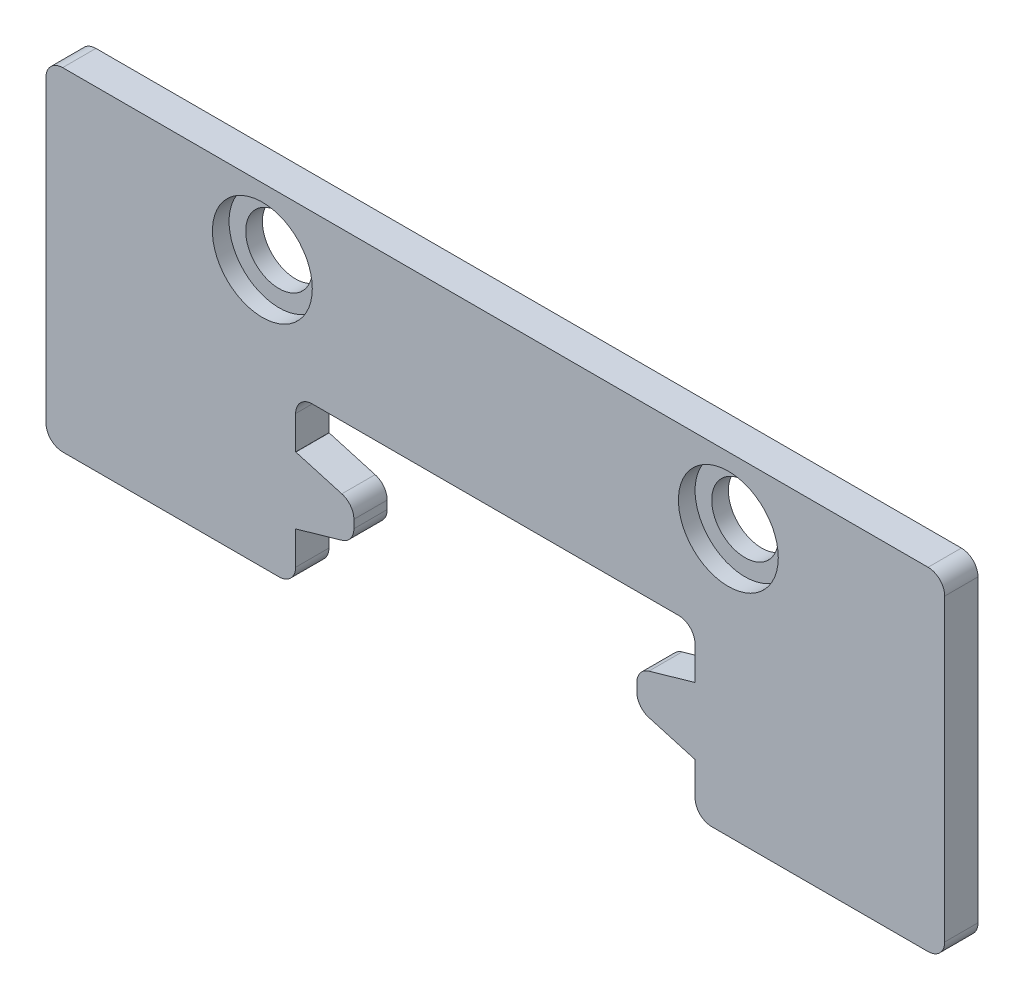
from build123d import *
from OCP.BRepFilletAPI import BRepFilletAPI_MakeChamfer

# Parameters (mm, degrees)
BOSS_EXTRUDE1_DEPTH = 1
CHAMFER1_SIZE       = 0.5
CHAMFER1_SIZE2      = 1.743707222
FILLET1_R           = 0.5
SKETCH2_R           = 1
CUT_EXTRUDE1_DEPTH  = 1
FILLET2_R           = 0.5
SKETCH3_R           = 1.5
CUT_EXTRUDE2_DEPTH  = 0.5


with BuildPart() as part:
    # Sketch1 → Boss-Extrude1 (new body)
    with BuildSketch(Plane.XY):
        Polygon((-6, -1.5), (-6, 0), (6, 0), (6, -1.5), (4.25, -1.5), (4.25, -3.5), (6, -3.5), (6, -5), (13.5, -5), (13.5, 5), (-13.5, 5), (-13.5, -5), (-6, -5), (-6, -3.5), (-4.25, -3.5), (-4.25, -1.5), align=None)
    extrude(amount=BOSS_EXTRUDE1_DEPTH)

    # Chamfer1: one chamfer whose edges measure the first distance from different faces: ONE call of the kernel's chamfer builder (chamfer() names one face for all edges)
    chamfer1_edges_1 = [part.edges().sort_by_distance(p)[0] for p in [
        (4.25, -3.5, 0.5),
        (4.25, -1.5, 0.5),
    ]]
    chamfer1_side_1 = [part.faces().sort_by_distance(p)[0] for p in [
        (4.25, -2.5, 0.5),
    ]]
    chamfer1_edges_2 = [part.edges().sort_by_distance(p)[0] for p in [
        (-4.25, -1.5, 0.5),
        (-4.25, -3.5, 0.5),
    ]]
    chamfer1_side_2 = [part.faces().sort_by_distance(p)[0] for p in [
        (-4.25, -2.5, 0.5),
    ]]
    chamfer1 = BRepFilletAPI_MakeChamfer(part.part.solid().wrapped)
    for e in chamfer1_edges_1:
        chamfer1.Add(CHAMFER1_SIZE, CHAMFER1_SIZE2, e.wrapped, chamfer1_side_1[0].wrapped)  # the first distance lies on this face
    for e in chamfer1_edges_2:
        chamfer1.Add(CHAMFER1_SIZE, CHAMFER1_SIZE2, e.wrapped, chamfer1_side_2[0].wrapped)  # the first distance lies on this face
    add(Compound.cast(chamfer1.Shape()), mode=Mode.REPLACE)

    # Fillet1
    fillet1_edges = [part.edges().sort_by_distance(p)[0] for p in [
        (4.25, -2, 0.5),
        (4.25, -3, 0.5),
        (-4.25, -2, 0.5),
        (-4.25, -3, 0.5),
    ]]
    fillet(fillet1_edges, radius=FILLET1_R)

    # Sketch2 → Cut-Extrude1 (cut)
    with BuildSketch(Plane.XY.offset(1)):
        with Locations((-7, 3)):
            Circle(SKETCH2_R)
        with Locations((7, 3)):
            Circle(SKETCH2_R)
    extrude(amount=-CUT_EXTRUDE1_DEPTH, mode=Mode.SUBTRACT)

    # Fillet2
    fillet2_edges = [part.edges().sort_by_distance(p)[0] for p in [
        (6, -5, 0.5),
        (6, 0, 0.5),
        (-6, 0, 0.5),
        (-6, -5, 0.5),
        (-13.5, -5, 0.5),
        (-13.5, 5, 0.5),
        (13.5, 5, 0.5),
        (13.5, -5, 0.5),
    ]]
    fillet(fillet2_edges, radius=FILLET2_R)

    # Sketch3 → Cut-Extrude2 (cut)
    with BuildSketch(Plane.XY.offset(1)):
        with Locations((-7, 3)):
            Circle(SKETCH3_R)
        with Locations((7, 3)):
            Circle(SKETCH3_R)
    extrude(amount=-CUT_EXTRUDE2_DEPTH, mode=Mode.SUBTRACT)


solid = part.part
